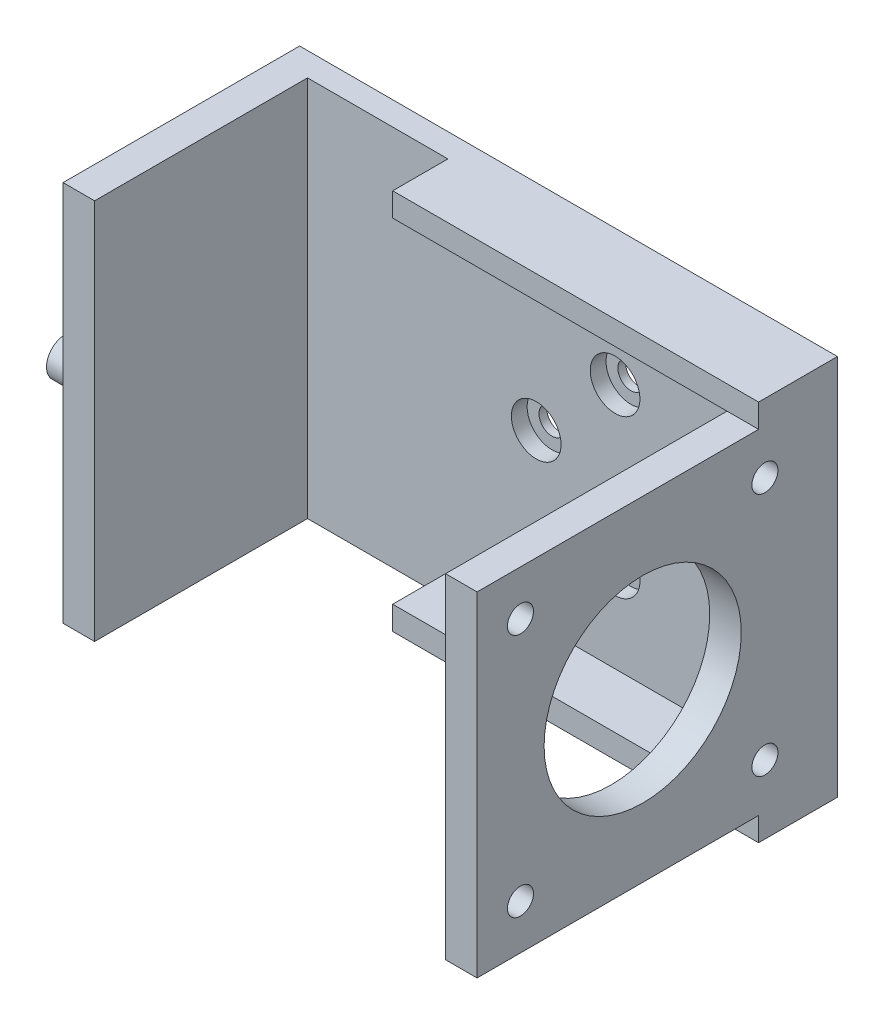
from build123d import *

# Parameters (mm, degrees)
SKETCH_1_W          = 42.4
SKETCH_1_H          = 42.4
SKETCH_1_R          = 3.15
EXTRUDE_1_DEPTH     = 3
SKETCH_1_3_R        = 3.15
SKETCH_1_3_R_2      = 1.65
EXTRUDE_2_DEPTH     = 1
SKETCH_2_W          = 4
SKETCH_2_H          = 42.4
EXTRUDE_3_DEPTH     = 45.7
SKETCH_3_R          = 1.65
SKETCH_3_R_2        = 12.5
CUT_EXTRUDE_2_DEPTH = 45.2
SKETCH_4_W          = 46.4
SKETCH_4_H          = 3
EXTRUDE_4_DEPTH     = 10
SKETCH_9_W          = 17.8
SKETCH_9_H          = 48.4
EXTRUDE_8_DEPTH     = 3
SKETCH_10_W         = 4
SKETCH_10_H         = 48.4
EXTRUDE_9_DEPTH     = 30
EXTRUDE_START       = -43
SKETCH_11_R         = 2.4
EXTRUDE_10_DEPTH    = 5


with BuildPart() as part:
    # 草图1 → 凸台-拉伸1 (new body)
    with BuildSketch(Plane.XY):
        Rectangle(SKETCH_1_W, SKETCH_1_H)
        with Locations((-10, 0)):
            Circle(SKETCH_1_R, mode=Mode.SUBTRACT)
        with Locations((0, -10)):
            Circle(SKETCH_1_R, mode=Mode.SUBTRACT)
        with Locations((10, 0)):
            Circle(SKETCH_1_R, mode=Mode.SUBTRACT)
        with Locations((0, 10)):
            Circle(SKETCH_1_R, mode=Mode.SUBTRACT)
    extrude(amount=EXTRUDE_1_DEPTH)

    # 草图1<3> → 凸台-拉伸2 (add)
    # profile 1 of 4: a face of its own
    with BuildSketch(Plane.XY):
        with Locations((-10, 0)):
            Circle(SKETCH_1_3_R)
        with Locations((-10, 0)):
            Circle(SKETCH_1_3_R_2, mode=Mode.SUBTRACT)
    # profile 2 of 4: a face of its own
    with BuildSketch(Plane.XY):
        with Locations((0, 10)):
            Circle(SKETCH_1_3_R)
        with Locations((0, 10)):
            Circle(SKETCH_1_3_R_2, mode=Mode.SUBTRACT)
    # profile 3 of 4: a face of its own
    with BuildSketch(Plane.XY):
        with Locations((10, 0)):
            Circle(SKETCH_1_3_R)
        with Locations((10, 0)):
            Circle(SKETCH_1_3_R_2, mode=Mode.SUBTRACT)
    # profile 4 of 4: a face of its own
    with BuildSketch(Plane.XY):
        with Locations((0, -10)):
            Circle(SKETCH_1_3_R)
        with Locations((0, -10)):
            Circle(SKETCH_1_3_R_2, mode=Mode.SUBTRACT)
    extrude(amount=EXTRUDE_2_DEPTH)

    # 草图2 → 凸台-拉伸3 (add)
    with BuildSketch(Plane.XY):
        with Locations((23.2, 0)):
            Rectangle(SKETCH_2_W, SKETCH_2_H)
    extrude(amount=EXTRUDE_3_DEPTH)

    # 草图3 → 切除-拉伸2 (cut)
    with BuildSketch(Plane(origin=(0, 0, 0), x_dir=(0, 0, -1), z_dir=(1, 0, 0))):
        with Locations(Location((-9.2, -15.5, 0), (0, 0, 180))):
            Circle(SKETCH_3_R)
        with Locations(Location((-40.2, -15.5, 0), (0, 0, 180))):
            Circle(SKETCH_3_R)
        with Locations(Location((-40.2, 15.5, 0), (0, 0, 180))):
            Circle(SKETCH_3_R)
        with Locations(Location((-9.2, 15.5, 0), (0, 0, 180))):
            Circle(SKETCH_3_R)
        with Locations(Location((-24.7, 0, 0), (0, 0, 180))):
            Circle(SKETCH_3_R_2)
    extrude(amount=CUT_EXTRUDE_2_DEPTH, mode=Mode.SUBTRACT)

    # 草图4 → 凸台-拉伸4 (add)
    with BuildSketch(Plane.XY):
        with Locations((2, -22.7)):
            Rectangle(SKETCH_4_W, SKETCH_4_H)
        with Locations((2, 22.7)):
            Rectangle(SKETCH_4_W, SKETCH_4_H)
    extrude(amount=EXTRUDE_4_DEPTH)

    # 草图9 → 凸台-拉伸8 (add)
    with BuildSketch(Plane.XY):
        with Locations((-30.1, 0)):
            Rectangle(SKETCH_9_W, SKETCH_9_H)
    extrude(amount=EXTRUDE_8_DEPTH)

    # 草图10 → 凸台-拉伸9 (add)
    with BuildSketch(Plane.XY):
        with Locations((-41, 0)):
            Rectangle(SKETCH_10_W, SKETCH_10_H)
    extrude(amount=EXTRUDE_9_DEPTH)

    # 草图11 → 凸台-拉伸10 (add)
    with BuildSketch(Plane(origin=(0, 0, 0), x_dir=(0, 0, -1), z_dir=(1, 0, 0)).offset(EXTRUDE_START)):
        with Locations((-24.7, 0)):
            Circle(SKETCH_11_R)
    extrude(amount=-EXTRUDE_10_DEPTH)


solid = part.part
